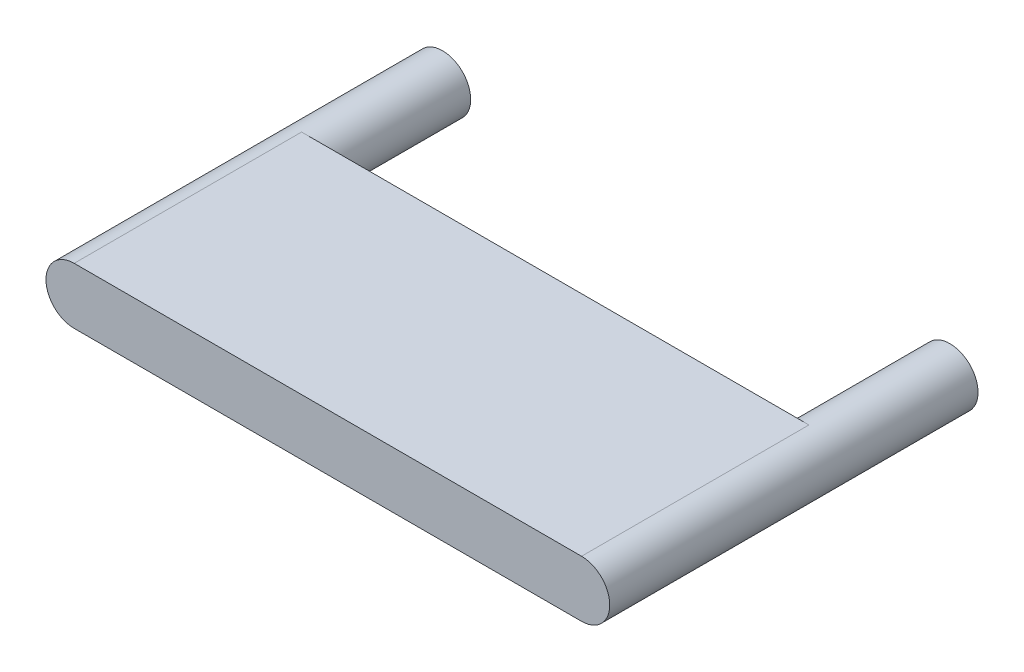
from build123d import *

# Parameters (mm, degrees)
SKETCH1_W           = 50.8
SKETCH1_H           = 25.4
BOSS_EXTRUDE1_DEPTH = 5.08
FILLET2_RADIUS      = 2.54
FILLET2_LENGTH      = 25.4
FILLET3_RADIUS      = 2.54
FILLET3_LENGTH      = 25.4
SKETCH2_R           = 2.54
BOSS_EXTRUDE2_DEPTH = 12.7
BOSS_EXTRUDE3_START = 12.7
SKETCH3_R           = 2.54
BOSS_EXTRUDE3_DEPTH = 12.7
SKETCH4_W           = 52.876932696
SKETCH4_H           = 9.818783706
CUT_EXTRUDE1_DEPTH  = 12.7


with BuildPart() as part:
    # Sketch1 → Boss-Extrude1 (new body)
    with BuildSketch(Plane(origin=(0, 0, 0), x_dir=(1, 0, 0), z_dir=(0, 1, 0))):
        Rectangle(SKETCH1_W, SKETCH1_H)
    extrude(amount=BOSS_EXTRUDE1_DEPTH)

    # Fillet2: full round fillet: the end face becomes a half cylinder, R = half its width
    fillet2_face = Plane((-25.4, 2.54, 0), x_dir=(0, 0, -1), z_dir=(-1, 0, 0))  # on the end face: x along it, z out of the body
    fillet2_slab = fillet2_face.offset(-FILLET2_RADIUS / 2) * Box(FILLET2_LENGTH, 2 * FILLET2_RADIUS, FILLET2_RADIUS, mode=Mode.PRIVATE)  # the body's end, R deep
    fillet2_round = Plane((-22.86, 2.54, 0), x_dir=(-1, 0, 0), z_dir=(0, 0, -1)) * Cylinder(FILLET2_RADIUS, FILLET2_LENGTH, mode=Mode.PRIVATE)  # its axis R under the face
    add(fillet2_slab - fillet2_round, mode=Mode.SUBTRACT)

    # Fillet3: full round fillet: the end face becomes a half cylinder, R = half its width
    fillet3_face = Plane((25.4, 2.54, 0), x_dir=(0, 0, 1), z_dir=(1, 0, 0))  # on the end face: x along it, z out of the body
    fillet3_slab = fillet3_face.offset(-FILLET3_RADIUS / 2) * Box(FILLET3_LENGTH, 2 * FILLET3_RADIUS, FILLET3_RADIUS, mode=Mode.PRIVATE)  # the body's end, R deep
    fillet3_round = Plane((22.86, 2.54, 0), x_dir=(1, 0, 0), z_dir=(0, 0, 1)) * Cylinder(FILLET3_RADIUS, FILLET3_LENGTH, mode=Mode.PRIVATE)  # its axis R under the face
    add(fillet3_slab - fillet3_round, mode=Mode.SUBTRACT)

    # Sketch2 → Boss-Extrude2 (add)
    with BuildSketch(Plane(origin=(0, 0, -12.7), x_dir=(-1, 0, 0), z_dir=(0, 0, -1))):
        with Locations((-22.86, 2.54)):
            Circle(SKETCH2_R)
    extrude(amount=BOSS_EXTRUDE2_DEPTH)

    # Sketch3 → Boss-Extrude3 (add)
    with BuildSketch(Plane(origin=(0, 0, -12.7), x_dir=(-1, 0, 0), z_dir=(0, 0, -1)).offset(BOSS_EXTRUDE3_START)):
        with Locations(Location((22.86, 2.54, 0), (0, 0, 90))):
            Circle(SKETCH3_R)
    extrude(amount=-BOSS_EXTRUDE3_DEPTH)

    # Sketch4 → Cut-Extrude1 (cut)
    with BuildSketch(Plane(origin=(0, 0, 0), x_dir=(-1, 0, 0), z_dir=(0, -1, 0))):
        with Locations((0, -12.7)):
            Rectangle(SKETCH4_W, SKETCH4_H)
    extrude(amount=-CUT_EXTRUDE1_DEPTH, mode=Mode.SUBTRACT)


solid = part.part
